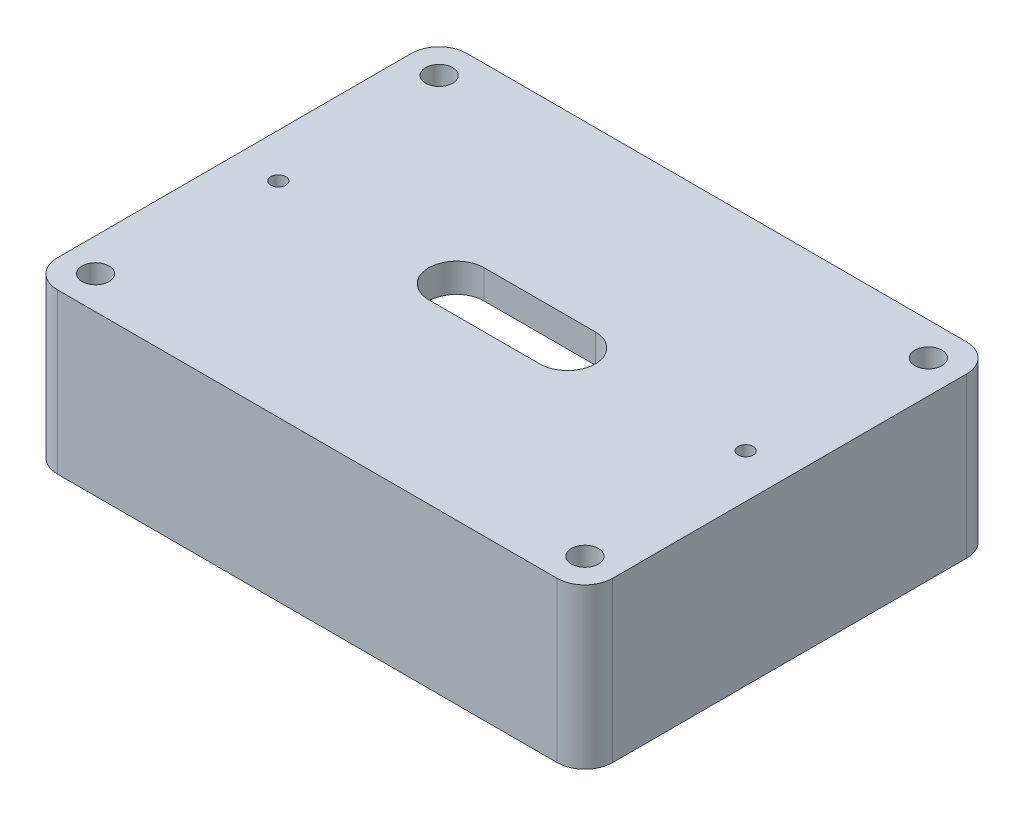
from build123d import *

# Parameters (mm, degrees)
SKETCH1_W           = 80
SKETCH1_H           = 59
BOSS_EXTRUDE1_DEPTH = 23
SKETCH2_R           = 1.95
CUT_EXTRUDE1_DEPTH  = 23
SHELL2_T            = -4.15
CUT_EXTRUDE2_DEPTH  = 23
SKETCH4_W           = 10
SKETCH4_H           = 3
CUT_EXTRUDE3_DEPTH  = 23
FILLET1_R           = 4
FILLET2_R           = 3
SKETCH5_R           = 1.08
CUT_EXTRUDE4_DEPTH  = 10
SKETCH6_W           = 2.4
SKETCH6_H           = 18
CUT_EXTRUDE5_DEPTH  = 18.85


with BuildPart() as part:
    # Sketch1 → Boss-Extrude1 (new body)
    with BuildSketch(Plane(origin=(0, 0, 0), x_dir=(1, 0, 0), z_dir=(0, 1, 0))):
        Rectangle(SKETCH1_W, SKETCH1_H)
    extrude(amount=BOSS_EXTRUDE1_DEPTH)

    # Sketch2 → Cut-Extrude1 (cut)
    with BuildSketch(Plane(origin=(0, 23, 0), x_dir=(1, 0, 0), z_dir=(0, 1, 0))):
        with Locations(Location((35.25, 24.75, 0), (0, 0, 270))):
            Circle(SKETCH2_R)
        with Locations(Location((35.25, -24.75, 0), (0, 0, 270))):
            Circle(SKETCH2_R)
        with Locations(Location((-35.25, 24.75, 0), (0, 0, 270))):
            Circle(SKETCH2_R)
        with Locations(Location((-35.25, -24.75, 0), (0, 0, 270))):
            Circle(SKETCH2_R)
    extrude(amount=-CUT_EXTRUDE1_DEPTH, mode=Mode.SUBTRACT)

    # Shell2
    shell2_openings = [part.faces().sort_by_distance(p)[0] for p in [
        (0, 0, 0),
    ]]
    offset(amount=SHELL2_T, openings=shell2_openings)

    # Sketch3 → Cut-Extrude2 (cut)
    with BuildSketch(Plane(origin=(0, 23, 0), x_dir=(1, 0, 0), z_dir=(0, 1, 0))):
        with BuildLine():
            Line((8, -4), (-8, -4))
            ThreePointArc((-8, -4), (-12, 0), (-8, 4))
            Line((-8, 4), (8, 4))
            ThreePointArc((8, 4), (12, 0), (8, -4))
        make_face()
    extrude(amount=-CUT_EXTRUDE2_DEPTH, mode=Mode.SUBTRACT)

    # Sketch4 → Cut-Extrude3 (cut)
    with BuildSketch(Plane.ZY.offset(40)):
        with Locations((0, 1.5)):
            Rectangle(SKETCH4_W, SKETCH4_H)
    extrude(amount=-CUT_EXTRUDE3_DEPTH, mode=Mode.SUBTRACT)

    # Fillet1
    fillet1_edges = [part.edges().sort_by_distance(p)[0] for p in [
        (40, 11.5, 29.5),
        (-40, 11.5, 29.5),
        (-40, 11.5, -29.5),
        (40, 11.5, -29.5),
    ]]
    fillet(fillet1_edges, radius=FILLET1_R)

    # Fillet2
    fillet2_edges = [part.edges().sort_by_distance(p)[0] for p in [
        (-40, 1.5, -5),
        (-40, 1.5, 5),
        (-40, 3, 0),
    ]]
    fillet(fillet2_edges, radius=FILLET2_R)

    # Sketch5 → Cut-Extrude4 (cut)
    with BuildSketch(Plane(origin=(0, 23, 0), x_dir=(1, 0, 0), z_dir=(0, 1, 0))):
        with Locations(Location((33.67, 0, 0), (0, 0, 270))):
            Circle(SKETCH5_R)
        with Locations(Location((-33.67, 0, 0), (0, 0, 270))):
            Circle(SKETCH5_R)
    extrude(amount=-CUT_EXTRUDE4_DEPTH, mode=Mode.SUBTRACT)

    # Sketch6 → Cut-Extrude5 (cut)
    with BuildSketch(Plane(origin=(0, 0, 0), x_dir=(-1, 0, 0), z_dir=(0, -1, 0))):
        with Locations((37.05, 0)):
            Rectangle(SKETCH6_W, SKETCH6_H)
    extrude(amount=-CUT_EXTRUDE5_DEPTH, mode=Mode.SUBTRACT)


solid = part.part
